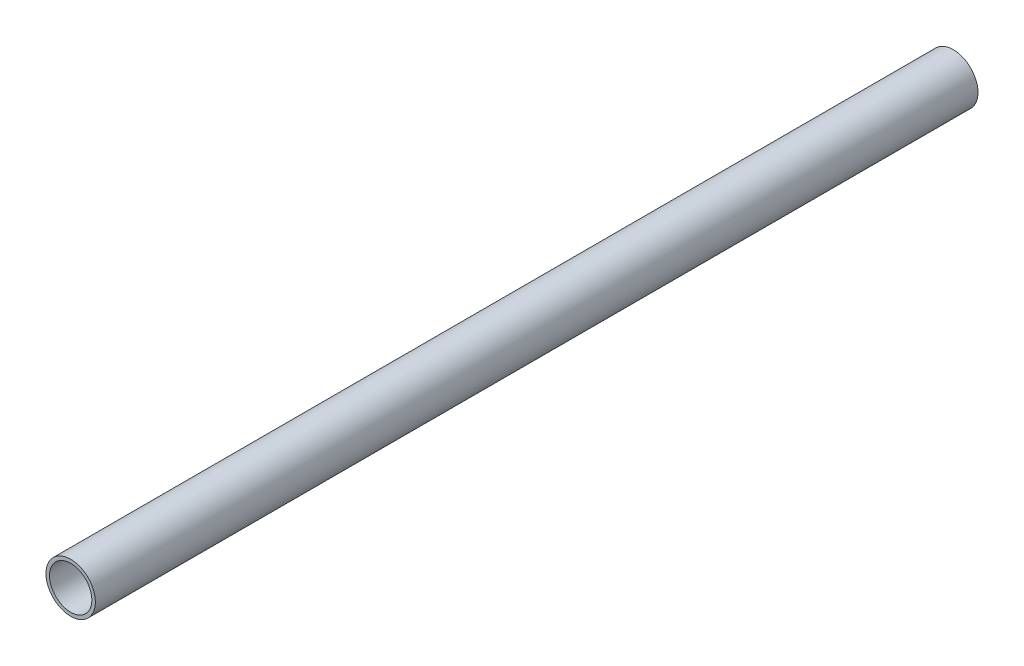
from build123d import *

# Parameters (mm, degrees)
SZKIC1_R                    = 7
SZKIC1_R_2                  = 6
DODANIE_WYCI_GNI_CIE1_DEPTH = 250


with BuildPart() as part:
    # Szkic1 → Dodanie-wyciągnięcie1 (new body)
    with BuildSketch(Plane.XY):
        Circle(SZKIC1_R)
        Circle(SZKIC1_R_2, mode=Mode.SUBTRACT)
    extrude(amount=DODANIE_WYCI_GNI_CIE1_DEPTH)


solid = part.part
